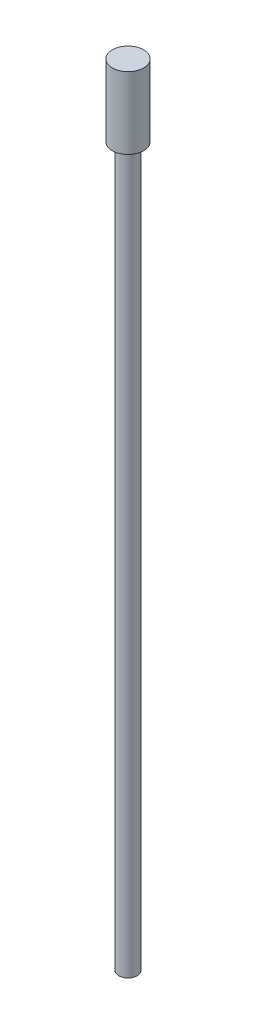
from build123d import *

# Parameters (mm, degrees)
SKETCH1_R           = 2.55
BOSS_EXTRUDE1_DEPTH = 200
SKETCH2_R           = 4.375
BOSS_EXTRUDE2_DEPTH = 20


with BuildPart() as part:
    # Sketch1 → Boss-Extrude1 (new body)
    with BuildSketch(Plane(origin=(0, 0, 0), x_dir=(1, 0, 0), z_dir=(0, 1, 0))):
        with Locations(Location((0, 0, 0), (0, 0, 270))):
            Circle(SKETCH1_R)
    extrude(amount=BOSS_EXTRUDE1_DEPTH)

    # Sketch2 → Boss-Extrude2 (add)
    with BuildSketch(Plane(origin=(0, 200, 0), x_dir=(1, 0, 0), z_dir=(0, 1, 0))):
        with Locations(Location((0, 0, 0), (0, 0, 270))):
            Circle(SKETCH2_R)
    extrude(amount=BOSS_EXTRUDE2_DEPTH)


solid = part.part
